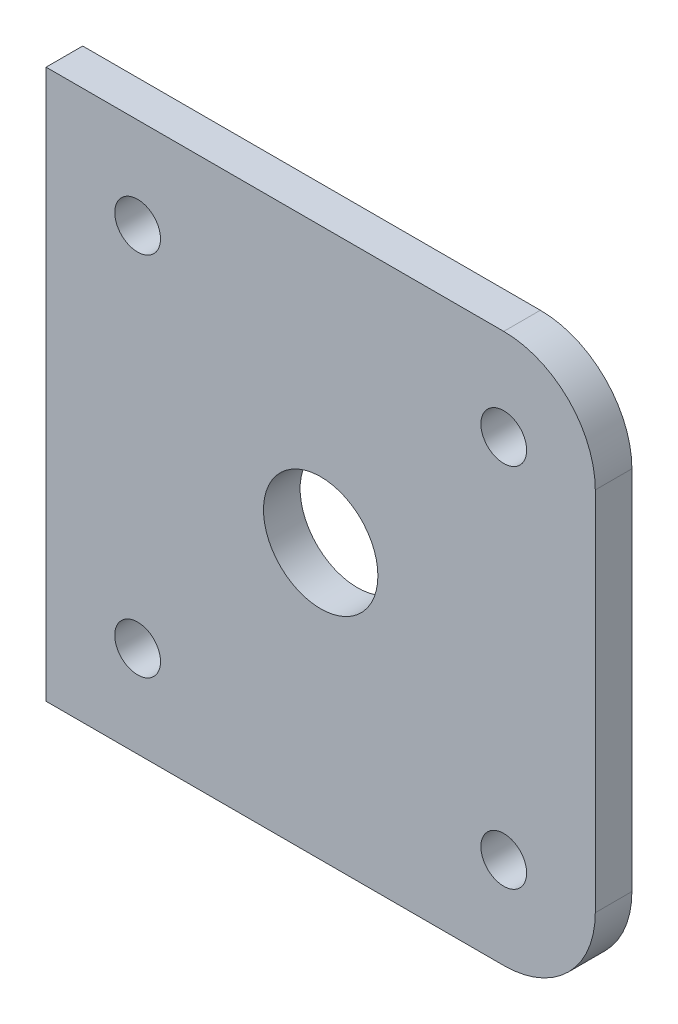
from build123d import *

# Parameters (mm, degrees)
SKETCH2_W            = 120
SKETCH2_H            = 120
BOSS_EXTRUDE1_DEPTH  = 8
SKETCH4_R            = 12.5
CUT_EXTRUDE1_DEPTH   = 86.229103011
SKETCH6_R            = 5
CUT_EXTRUDE2_DEPTH   = 86.229103011
LPATTERN1_COUNT      = 2
LPATTERN1_PITCH      = 80
LPATTERN1_COUNT_DIR2 = 2
LPATTERN1_PITCH_DIR2 = 80
FILLET2_R            = 20


with BuildPart() as part:
    # Sketch2 → Boss-Extrude1 (new body)
    with BuildSketch(Plane.XY):
        Rectangle(SKETCH2_W, SKETCH2_H)
    extrude(amount=BOSS_EXTRUDE1_DEPTH)

    # Sketch4 → Cut-Extrude1 (cut, through all)
    with BuildSketch(Plane.XY.offset(8)):
        Circle(SKETCH4_R)
    extrude(amount=-CUT_EXTRUDE1_DEPTH, mode=Mode.SUBTRACT)

    # Sketch6 → Cut-Extrude2 (cut, through all)
    with BuildSketch(Plane.XY.offset(8)):
        with Locations((-40, 40)):
            Circle(SKETCH6_R)
    cut_extrude2 = extrude(amount=-CUT_EXTRUDE2_DEPTH, mode=Mode.SUBTRACT)

    # LPattern1: Cut-Extrude2 2 × 2
    with Locations(*[(i * LPATTERN1_PITCH, -j * LPATTERN1_PITCH_DIR2, 0) for i in range(LPATTERN1_COUNT) for j in range(LPATTERN1_COUNT_DIR2) if (i, j) != (0, 0)]):
        add(cut_extrude2, mode=Mode.SUBTRACT)

    # Fillet2
    fillet2_edges = [part.edges().sort_by_distance(p)[0] for p in [
        (60, -60, 4),
        (60, 60, 4),
    ]]
    fillet(fillet2_edges, radius=FILLET2_R)


solid = part.part
